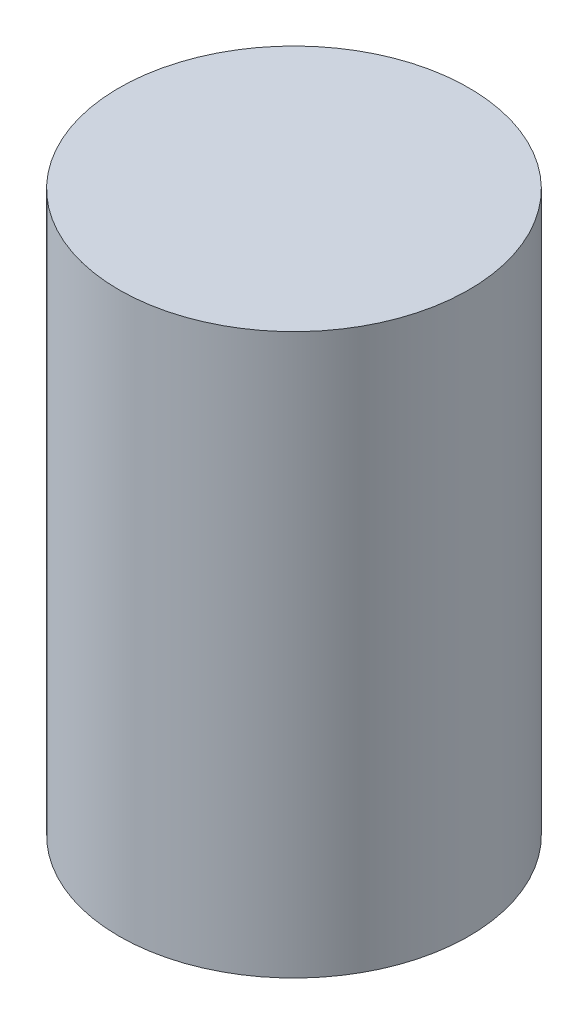
from build123d import *

# Parameters (mm, degrees)
SKETCH_1_R      = 12.5
EXTRUDE_1_DEPTH = 40


with BuildPart() as part:
    # Эскиз1 → Вытянуть1 (new body)
    with BuildSketch(Plane(origin=(0, 0, 0), x_dir=(1, 0, 0), z_dir=(0, 1, 0))):
        with Locations(Location((0, 0, 0), (0, 0, 270))):
            Circle(SKETCH_1_R)
    extrude(amount=EXTRUDE_1_DEPTH)


solid = part.part
